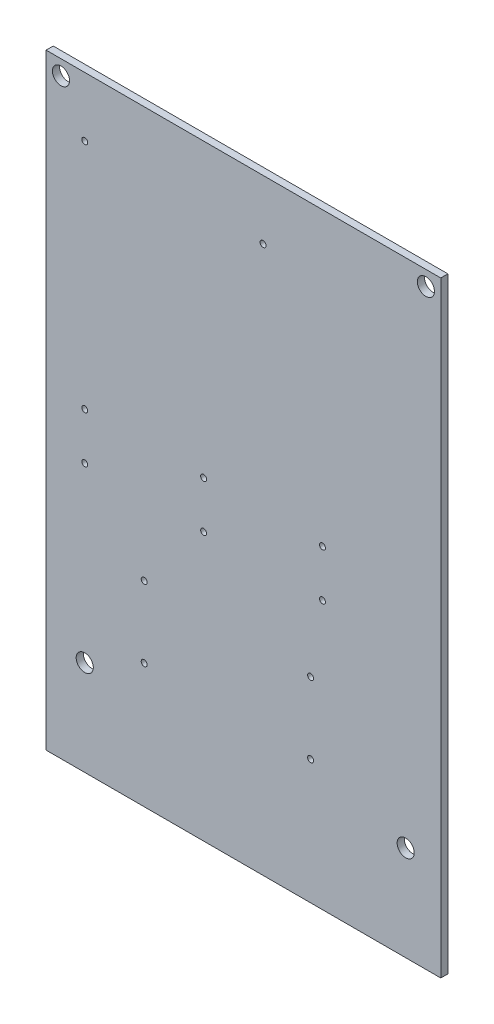
from build123d import *

# Parameters (mm, degrees)
SKETCH1_W                  = 84.328
SKETCH1_H                  = 165.1
SKETCH1_R                  = 1.8288
EXTRUDE1_DEPTH             = 1.524
SKETCH3_R                  = 0.635
LCD_HOLES_DEPTH            = 93.707216397
SKETCH4_R                  = 0.635
POT_HOLES_DEPTH            = 93.707216397
SKETCH5_R                  = 0.635
ARDUINO_HEADER_HOLES_DEPTH = 93.707216397
SKETCH6_W                  = 84.328
SKETCH6_H                  = 35.56
CUT_EXTRUDE1_DEPTH         = 93.707216397


with BuildPart() as part:
    # Sketch1 → Extrude1 (new body)
    with BuildSketch(Plane.XY):
        Rectangle(SKETCH1_W, SKETCH1_H)
        with Locations(Location((-38.989, 79.375, 0), (0, 0, 180))):
            Circle(SKETCH1_R, mode=Mode.SUBTRACT)
        with Locations(Location((38.989, 79.375, 0), (0, 0, 180))):
            Circle(SKETCH1_R, mode=Mode.SUBTRACT)
        with Locations(Location((-38.989, -79.375, 0), (0, 0, 180))):
            Circle(SKETCH1_R, mode=Mode.SUBTRACT)
        with Locations(Location((38.989, -79.375, 0), (0, 0, 180))):
            Circle(SKETCH1_R, mode=Mode.SUBTRACT)
        with Locations(Location((-33.909, -26.67, 0), (0, 0, 180))):
            Circle(SKETCH1_R, mode=Mode.SUBTRACT)
        with Locations(Location((34.671, -26.67, 0), (0, 0, 180))):
            Circle(SKETCH1_R, mode=Mode.SUBTRACT)
    extrude(amount=EXTRUDE1_DEPTH)

    # Sketch3 → LCD holes (cut, through all)
    with BuildSketch(Plane.XY.offset(1.524)):
        with Locations((-33.909, 69.85)):
            Circle(SKETCH3_R)
        with Locations((4.191, 69.85)):
            Circle(SKETCH3_R)
    extrude(amount=-LCD_HOLES_DEPTH, mode=Mode.SUBTRACT)

    # Sketch4 → Pot Holes (cut, through all)
    with BuildSketch(Plane.XY.offset(1.524)):
        with Locations((-33.909, 20.24)):
            Circle(SKETCH4_R)
        with Locations((-33.909, 10.24)):
            Circle(SKETCH4_R)
        with Locations((-8.509, 10.24)):
            Circle(SKETCH4_R)
        with Locations((-8.509, 20.24)):
            Circle(SKETCH4_R)
        with Locations((16.891, 10.24)):
            Circle(SKETCH4_R)
        with Locations((16.891, 20.24)):
            Circle(SKETCH4_R)
    extrude(amount=-POT_HOLES_DEPTH, mode=Mode.SUBTRACT)

    # Sketch5 → Arduino Header holes (cut, through all)
    with BuildSketch(Plane.XY.offset(1.524)):
        with Locations((-21.209, -5.16)):
            Circle(SKETCH5_R)
        with Locations((14.351, -5.16)):
            Circle(SKETCH5_R)
        with Locations((-21.209, -20.4)):
            Circle(SKETCH5_R)
        with Locations((14.351, -20.4)):
            Circle(SKETCH5_R)
    extrude(amount=-ARDUINO_HEADER_HOLES_DEPTH, mode=Mode.SUBTRACT)

    # Sketch6 → Cut-Extrude1 (cut, through all)
    with BuildSketch(Plane.XY.offset(1.524)):
        with Locations((0, -64.77)):
            Rectangle(SKETCH6_W, SKETCH6_H)
    extrude(amount=-CUT_EXTRUDE1_DEPTH, mode=Mode.SUBTRACT)


solid = part.part
